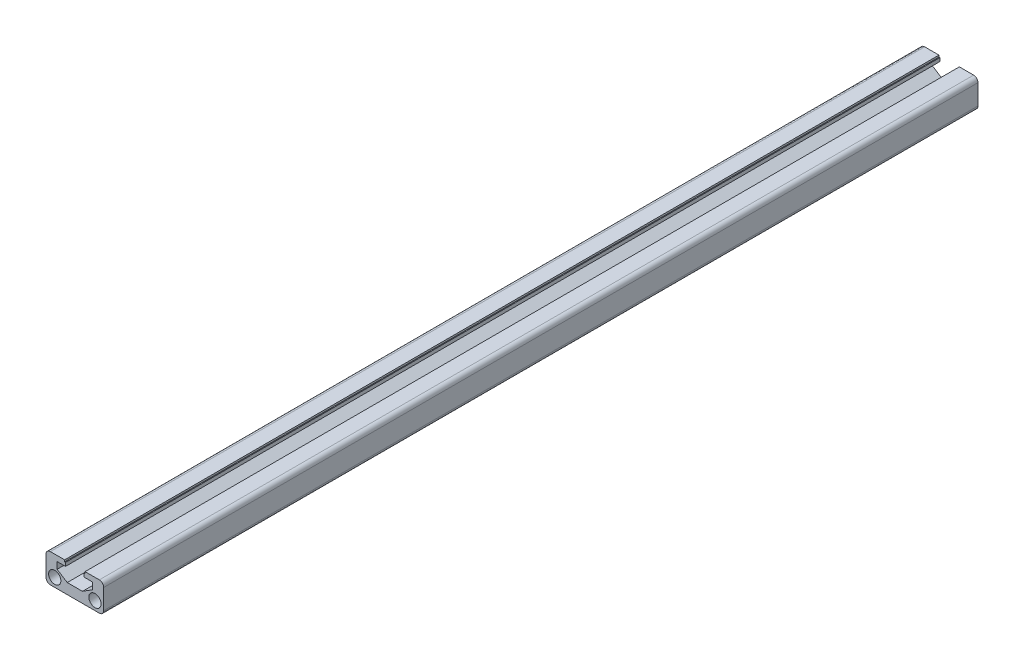
from build123d import *

# Parameters (mm, degrees)
SKETCH_1_R      = 2.1
EXTRUDE_1_DEPTH = 300


with BuildPart() as part:
    # 草图1 → 凸台-拉伸1 (new body)
    with BuildSketch(Plane.XY):
        with BuildLine():
            Line((8.4, -4.95), (-8.4, -4.95))
            ThreePointArc((-8.4, -4.95), (-9.460660172, -4.510660172), (-9.9, -3.45))
            Line((-9.9, -3.45), (-9.9, 3.45))
            ThreePointArc((-9.9, 3.45), (-9.460660172, 4.510660172), (-8.4, 4.95))
            Line((-8.4, 4.95), (-3.5, 4.95))
            Line((-3.5, 4.95), (-3.5, 4.338498403))
            Line((-3.5, 4.338498403), (-3.2, 4.338498403))
            Line((-3.2, 4.338498403), (-3.2, 3.15))
            Line((-3.2, 3.15), (-6.074788311, 3.15))
            Line((-6.074788311, 3.15), (-6.074788311, 0.842971246))
            Line((-6.074788311, 0.842971246), (-2.616641346, -1.35))
            Line((-2.616641346, -1.35), (2.616641346, -1.35))
            Line((2.616641346, -1.35), (6.074788311, 0.842971246))
            Line((6.074788311, 0.842971246), (6.074788311, 3.15))
            Line((6.074788311, 3.15), (3.2, 3.15))
            Line((3.2, 3.15), (3.2, 4.338498403))
            Line((3.2, 4.338498403), (3.5, 4.338498403))
            Line((3.5, 4.338498403), (3.5, 4.95))
            Line((3.5, 4.95), (8.4, 4.95))
            ThreePointArc((8.4, 4.95), (9.460660172, 4.510660172), (9.9, 3.45))
            Line((9.9, 3.45), (9.9, -3.45))
            ThreePointArc((9.9, -3.45), (9.460660172, -4.510660172), (8.4, -4.95))
        make_face()
        with Locations((-6.9, -1.95)):
            Circle(SKETCH_1_R, mode=Mode.SUBTRACT)
        with Locations(Location((6.9, -1.95, 0), (0, 0, 180))):
            Circle(SKETCH_1_R, mode=Mode.SUBTRACT)
    extrude(amount=EXTRUDE_1_DEPTH)


solid = part.part
